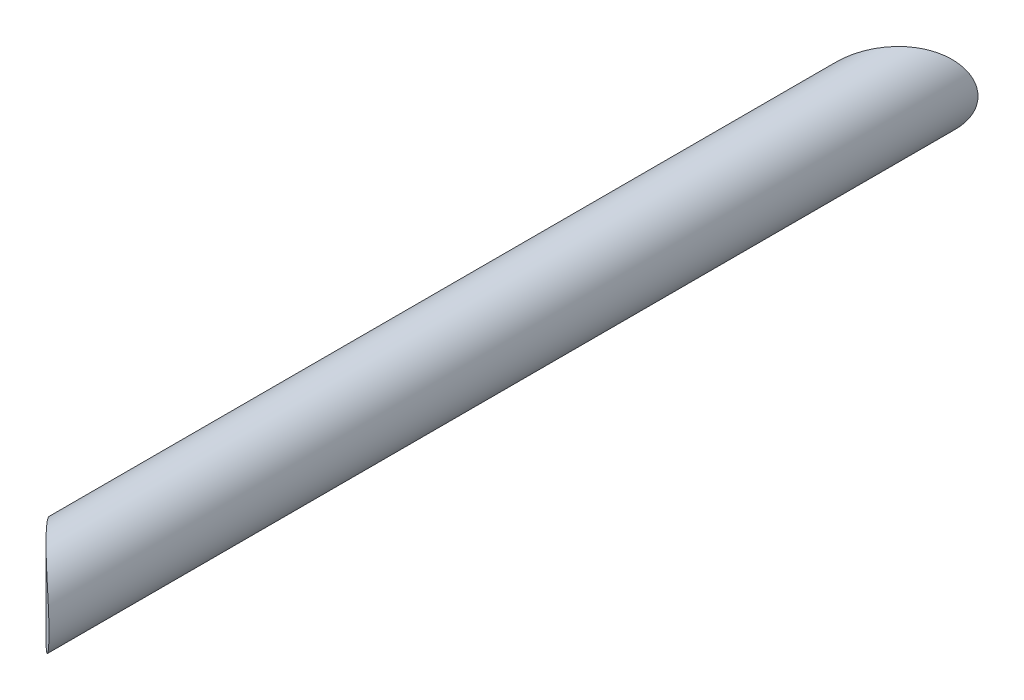
from build123d import *

# Parameters (mm, degrees)
BOSS_EXTRUDE1_DEPTH      = 40
BOSS_EXTRUDE1_DEPTH_BACK = 40
SKETCH3_R                = 2.4
CUT_EXTRUDE1_START       = 2.6
SKETCH1_R                = 50
SKETCH1_R_2              = 35
CUT_EXTRUDE1_DEPTH       = 4.8
SCALE1_SCALE             = 0.8


with BuildPart() as part:
    # Sketch3 → Boss-Extrude1 (new, two sides: drawn at the far end of the back side and taken through both)
    with BuildSketch(Plane.XY.offset(-BOSS_EXTRUDE1_DEPTH_BACK)):
        with Locations((-25, 5)):
            Circle(SKETCH3_R)
    extrude(amount=BOSS_EXTRUDE1_DEPTH + BOSS_EXTRUDE1_DEPTH_BACK)

    # Sketch1 → Cut-Extrude1 (cut)
    with BuildSketch(Plane(origin=(0, 0, 0), x_dir=(1, 0, 0), z_dir=(0, 1, 0)).offset(CUT_EXTRUDE1_START)):
        Circle(SKETCH1_R)
        Circle(SKETCH1_R_2, mode=Mode.SUBTRACT)
    extrude(amount=CUT_EXTRUDE1_DEPTH, mode=Mode.SUBTRACT)


with BuildPart() as part_1:
    # Scale1: scaled about (-24.939549166, 4.999999342, -0.000153755)
    add(part.part.scale(SCALE1_SCALE).moved(Location((-4.987909833, 0.999999868, -3.0751e-05))))


solid = part_1.part
